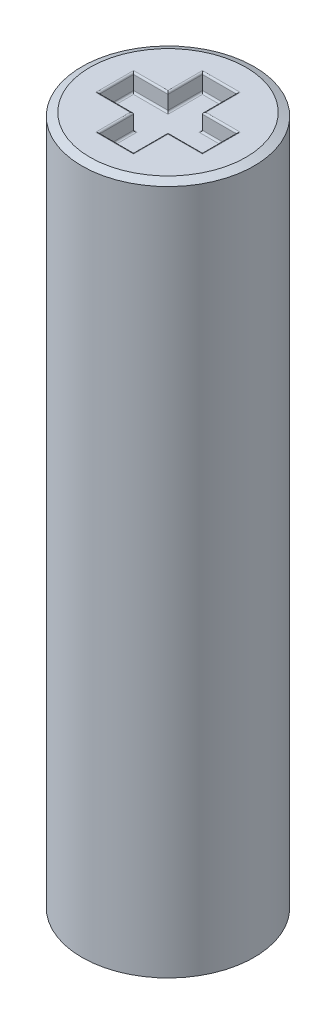
from build123d import *

# Parameters (mm, degrees)
SKETCH1_R           = 2.5
BOSS_EXTRUDE1_DEPTH = 20
CHAMFER1_SIZE       = 0.1
CHAMFER1_SIZE2      = 0.235585237
CUT_EXTRUDE1_DEPTH  = 0.5
FILLET1_R           = 0.05


with BuildPart() as part:
    # Sketch1 → Boss-Extrude1 (new body)
    with BuildSketch(Plane(origin=(0, 0, 0), x_dir=(1, 0, 0), z_dir=(0, 1, 0))):
        with Locations(Location((0, 0, 0), (0, 0, 270))):
            Circle(SKETCH1_R)
    extrude(amount=BOSS_EXTRUDE1_DEPTH)

    # Chamfer1
    chamfer1_edges = [part.edges().sort_by_distance(p)[0] for p in [
        (0, 20, -2.5),
    ]]
    chamfer1_side = [part.faces().sort_by_distance(p)[0] for p in [
        (0, 10, -2.5),
    ]]
    chamfer(chamfer1_edges, length=CHAMFER1_SIZE, length2=CHAMFER1_SIZE2, reference=chamfer1_side[0])

    # Sketch2 → Cut-Extrude1 (cut)
    with BuildSketch(Plane(origin=(0, 20, 0), x_dir=(1, 0, 0), z_dir=(0, 1, 0))):
        Polygon((0.5, 0.5), (0.5, 1.5), (-0.5, 1.5), (-0.5, 0.5), (-1.5, 0.5), (-1.5, -0.5), (-0.5, -0.5), (-0.5, -1.5), (0.5, -1.5), (0.5, -0.5), (1.5, -0.5), (1.5, 0.5), align=None)
    extrude(amount=-CUT_EXTRUDE1_DEPTH, mode=Mode.SUBTRACT)

    # Fillet1
    fillet1_edges = [part.edges().sort_by_distance(p)[0] for p in [
        (-0.5, 19.5, -1),
        (0, 19.5, -1.5),
        (0.5, 19.5, -1),
        (1, 19.5, -0.5),
        (1.5, 19.5, 0),
        (1, 19.5, 0.5),
        (0.5, 19.5, 1),
        (0, 19.5, 1.5),
        (-0.5, 19.5, 1),
        (-1, 19.5, 0.5),
        (-1.5, 19.5, 0),
        (-1, 19.5, -0.5),
        (-0.5, 20, -1),
        (-1, 20, -0.5),
        (-1.5, 20, 0),
        (-1, 20, 0.5),
        (-0.5, 20, 1),
        (0, 20, 1.5),
        (0.5, 20, 1),
        (1, 20, 0.5),
        (1.5, 20, 0),
        (1, 20, -0.5),
        (0.5, 20, -1),
        (0, 20, -1.5),
    ]]
    fillet(fillet1_edges, radius=FILLET1_R)


solid = part.part
